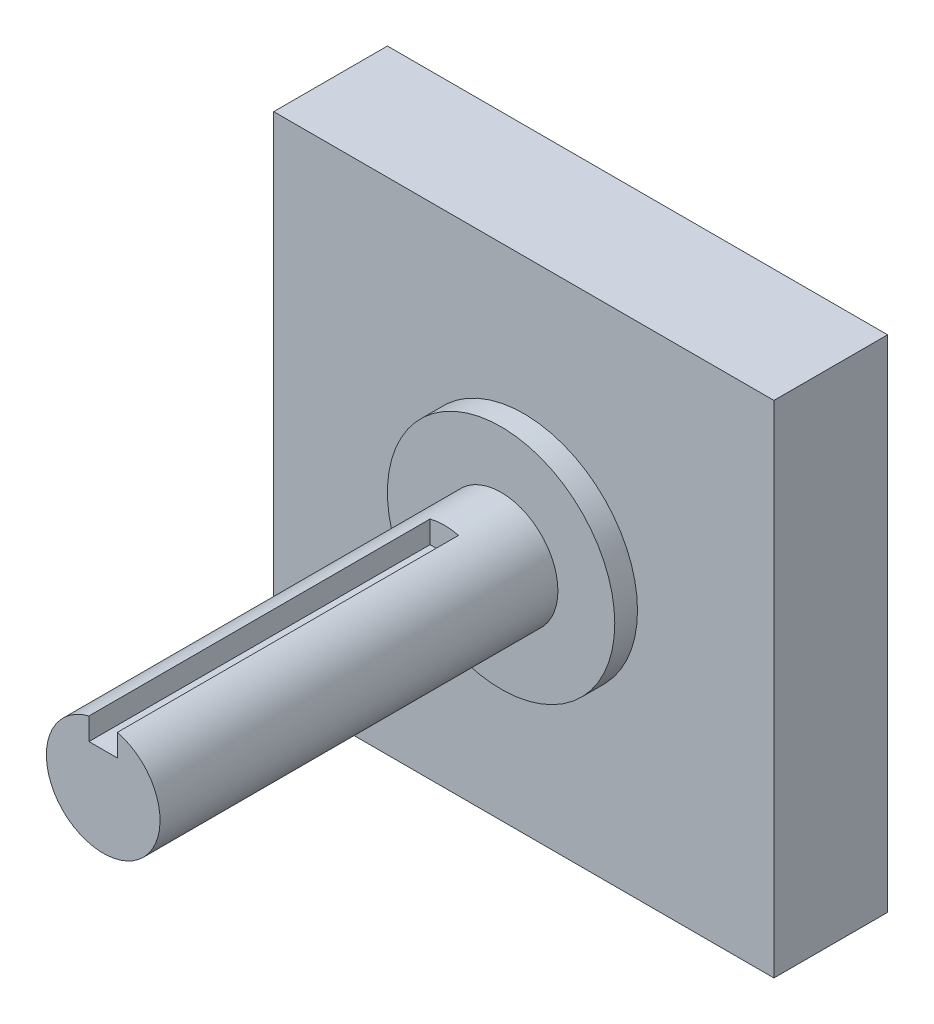
from build123d import *

# Parameters (mm, degrees)
SKETCH1_W           = 44
SKETCH1_H           = 44
BOSS_EXTRUDE1_DEPTH = 10
SKETCH2_R           = 5
BOSS_EXTRUDE2_DEPTH = 37
SKETCH3_R           = 5
BOSS_EXTRUDE3_DEPTH = 3
SKETCH4_R           = 5
CUT_EXTRUDE1_DEPTH  = 3
SKETCH5_R           = 2.5
CUT_EXTRUDE2_DEPTH  = 41
SKETCH6_R           = 10
BOSS_EXTRUDE4_DEPTH = 2
SKETCH7_W           = 2.5
SKETCH7_H           = 3
CUT_EXTRUDE3_DEPTH  = 30


with BuildPart() as part:
    # Sketch1 → Boss-Extrude1 (new body)
    with BuildSketch(Plane.XY):
        Rectangle(SKETCH1_W, SKETCH1_H)
    extrude(amount=BOSS_EXTRUDE1_DEPTH)

    # Sketch2 → Boss-Extrude2 (add)
    with BuildSketch(Plane.XY.offset(10)):
        Circle(SKETCH2_R)
    extrude(amount=BOSS_EXTRUDE2_DEPTH)

    # Sketch3 → Boss-Extrude3 (add)
    with BuildSketch(Plane(origin=(0, 0, 0), x_dir=(-1, 0, 0), z_dir=(0, 0, -1))):
        with Locations(Location((0, 0, 0), (0, 0, 180))):
            Circle(SKETCH3_R)
    extrude(amount=-BOSS_EXTRUDE3_DEPTH)

    # Sketch4 → Cut-Extrude1 (cut)
    with BuildSketch(Plane(origin=(0, 0, 0), x_dir=(-1, 0, 0), z_dir=(0, 0, -1))):
        with Locations(Location((0, 0, 0), (0, 0, 180))):
            Circle(SKETCH4_R)
    extrude(amount=-CUT_EXTRUDE1_DEPTH, mode=Mode.SUBTRACT)

    # Sketch5 → Cut-Extrude2 (cut)
    with BuildSketch(Plane.ZY.offset(22)):
        with Locations((5, -11)):
            Circle(SKETCH5_R)
        with Locations((5, 11)):
            Circle(SKETCH5_R)
    extrude(amount=-CUT_EXTRUDE2_DEPTH, mode=Mode.SUBTRACT)

    # Sketch6 → Boss-Extrude4 (add)
    with BuildSketch(Plane.XY.offset(10)):
        Circle(SKETCH6_R)
    extrude(amount=BOSS_EXTRUDE4_DEPTH)

    # Sketch7 → Cut-Extrude3 (cut)
    with BuildSketch(Plane.XY.offset(47)):
        with Locations((0, 4.385245902)):
            Rectangle(SKETCH7_W, SKETCH7_H)
    extrude(amount=-CUT_EXTRUDE3_DEPTH, mode=Mode.SUBTRACT)


solid = part.part
